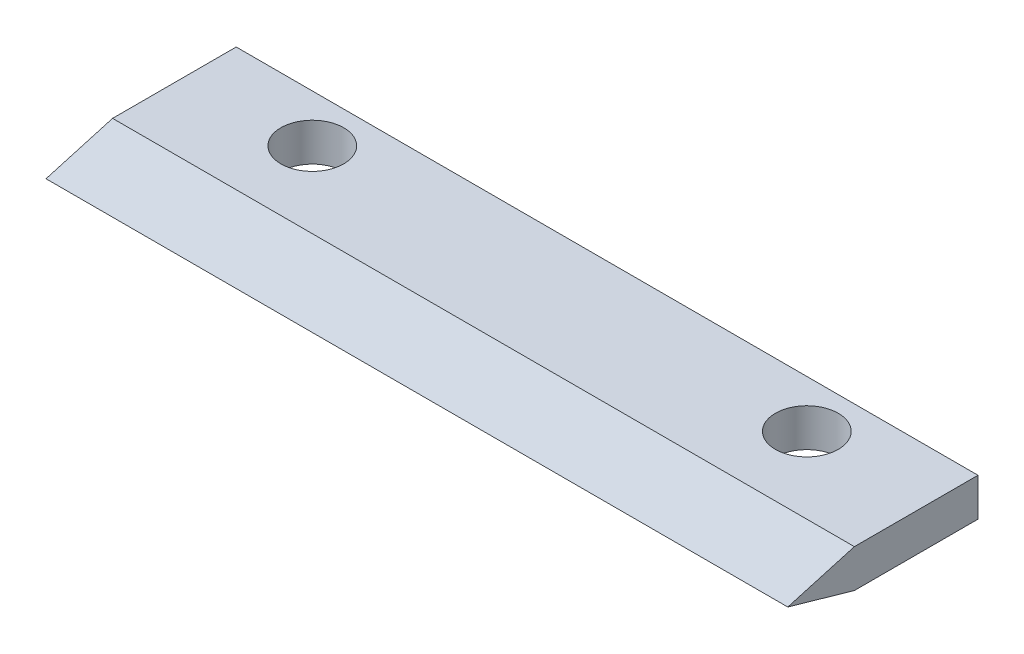
from build123d import *

# Parameters (mm, degrees)
SKETCH_1_W          = 39
SKETCH_1_H          = 10
SKETCH_1_R          = 1.65
EXTRUDE_1_DEPTH     = 2
CUT_EXTRUDE_1_DEPTH = 42
CUT_EXTRUDE_2_DEPTH = 42


with BuildPart() as part:
    # 草图1 → 凸台-拉伸1 (new body)
    with BuildSketch(Plane(origin=(0, 0, 0), x_dir=(1, 0, 0), z_dir=(0, 1, 0))):
        with Locations((19.5, 5)):
            Rectangle(SKETCH_1_W, SKETCH_1_H)
        with Locations(Location((6.5, 7.5, 0), (0, 0, 270))):
            Circle(SKETCH_1_R, mode=Mode.SUBTRACT)
        with Locations(Location((32.5, 7.5, 0), (0, 0, 270))):
            Circle(SKETCH_1_R, mode=Mode.SUBTRACT)
    extrude(amount=EXTRUDE_1_DEPTH)

    # 草图2 → 切除-拉伸1 (cut)
    with BuildSketch(Plane(origin=(39, 0, 0), x_dir=(0, 0, -1), z_dir=(1, 0, 0))):
        Polygon((3.5, 2), (0, 2), (0, 1), align=None)
    extrude(amount=-CUT_EXTRUDE_1_DEPTH, mode=Mode.SUBTRACT)

    # 草图3 → 切除-拉伸2 (cut)
    with BuildSketch(Plane(origin=(39, 0, 0), x_dir=(0, 0, -1), z_dir=(1, 0, 0))):
        Polygon((0, 1), (0, 0), (3.5, 0), align=None)
    extrude(amount=-CUT_EXTRUDE_2_DEPTH, mode=Mode.SUBTRACT)


solid = part.part
